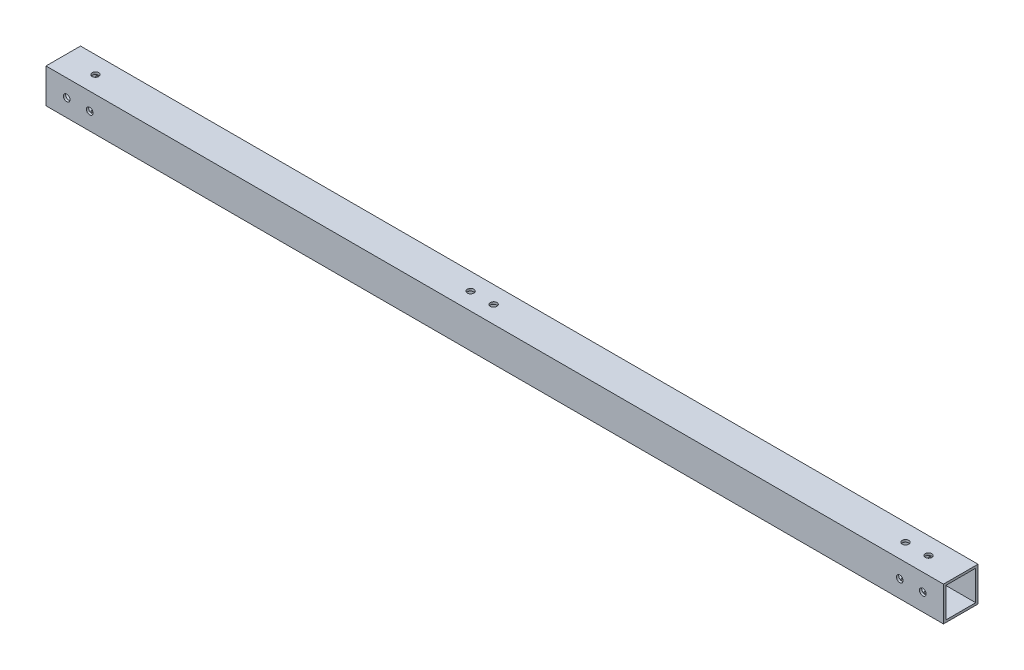
from build123d import *

# Parameters (mm, degrees)
SKETCH_1_W          = 15
SKETCH_1_H          = 15
SKETCH_1_W_2        = 13
SKETCH_1_H_2        = 13
EXTRUDE_1_DEPTH     = 390
SKETCH_2_R          = 1.45
CUT_EXTRUDE_1_DEPTH = 391.36041039
SKETCH_3_R          = 1.45
CUT_EXTRUDE_2_DEPTH = 391.36041039


with BuildPart() as part:
    # 草图1 → 凸台-拉伸1 (new body)
    with BuildSketch(Plane(origin=(0, 0, 0), x_dir=(0, 0, -1), z_dir=(1, 0, 0))):
        Rectangle(SKETCH_1_W, SKETCH_1_H)
        Rectangle(SKETCH_1_W_2, SKETCH_1_H_2, mode=Mode.SUBTRACT)
    extrude(amount=EXTRUDE_1_DEPTH)

    # 草图2 → 切除-拉伸1 (cut, through all)
    with BuildSketch(Plane(origin=(0, 7.5, 0), x_dir=(1, 0, 0), z_dir=(0, 1, 0))):
        with Locations(Location((14, 0, 0), (0, 0, 270))):
            Circle(SKETCH_2_R)
        with Locations(Location((366, 0, 0), (0, 0, 270))):
            Circle(SKETCH_2_R)
        with Locations(Location((376, 0, 0), (0, 0, 270))):
            Circle(SKETCH_2_R)
        with Locations(Location((177, 0, 0), (0, 0, 270))):
            Circle(SKETCH_2_R)
        with Locations(Location((187, 0, 0), (0, 0, 270))):
            Circle(SKETCH_2_R)
    extrude(amount=-CUT_EXTRUDE_1_DEPTH, mode=Mode.SUBTRACT)

    # 草图3 → 切除-拉伸2 (cut, through all)
    with BuildSketch(Plane(origin=(0, 0, -7.5), x_dir=(-1, 0, 0), z_dir=(0, 0, -1))):
        with Locations((-381, 0)):
            Circle(SKETCH_3_R)
        with Locations((-371, 0)):
            Circle(SKETCH_3_R)
        with Locations((-9, 0)):
            Circle(SKETCH_3_R)
        with Locations((-19, 0)):
            Circle(SKETCH_3_R)
    extrude(amount=-CUT_EXTRUDE_2_DEPTH, mode=Mode.SUBTRACT)


solid = part.part
